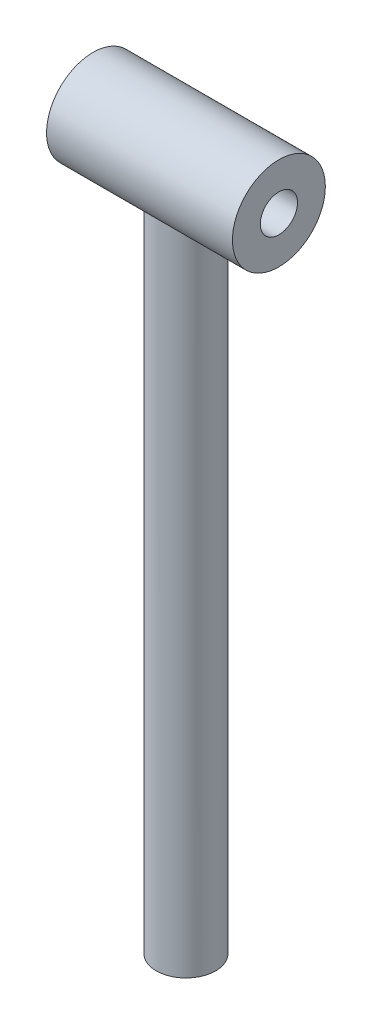
from build123d import *

# Parameters (mm, degrees)
DODANIE_WYCI_GNI_CIE1_DEPTH      = 25
DODANIE_WYCI_GNI_CIE1_DEPTH_BACK = 25
SZKIC2_R                         = 12.5
SZKIC2_R_2                       = 5
SZKIC3_R                         = 8
DODANIE_WYCI_GNI_CIE2_DEPTH      = 180


with BuildPart() as part:
    # Szkic2 → Dodanie-wyciągnięcie1 (new, two sides: drawn at the far end of the back side and taken through both)
    with BuildSketch(Plane(origin=(0, 0, 0), x_dir=(0, 0, -1), z_dir=(1, 0, 0)).offset(-DODANIE_WYCI_GNI_CIE1_DEPTH_BACK)):
        Circle(SZKIC2_R)
        Circle(SZKIC2_R_2, mode=Mode.SUBTRACT)
    extrude(amount=DODANIE_WYCI_GNI_CIE1_DEPTH + DODANIE_WYCI_GNI_CIE1_DEPTH_BACK)

    # Szkic3 → Dodanie-wyciągnięcie2 (add)
    with BuildSketch(Plane(origin=(0, -5, 0), x_dir=(1, 0, 0), z_dir=(0, 1, 0))):
        Circle(SZKIC3_R)
    extrude(amount=-DODANIE_WYCI_GNI_CIE2_DEPTH)


solid = part.part
